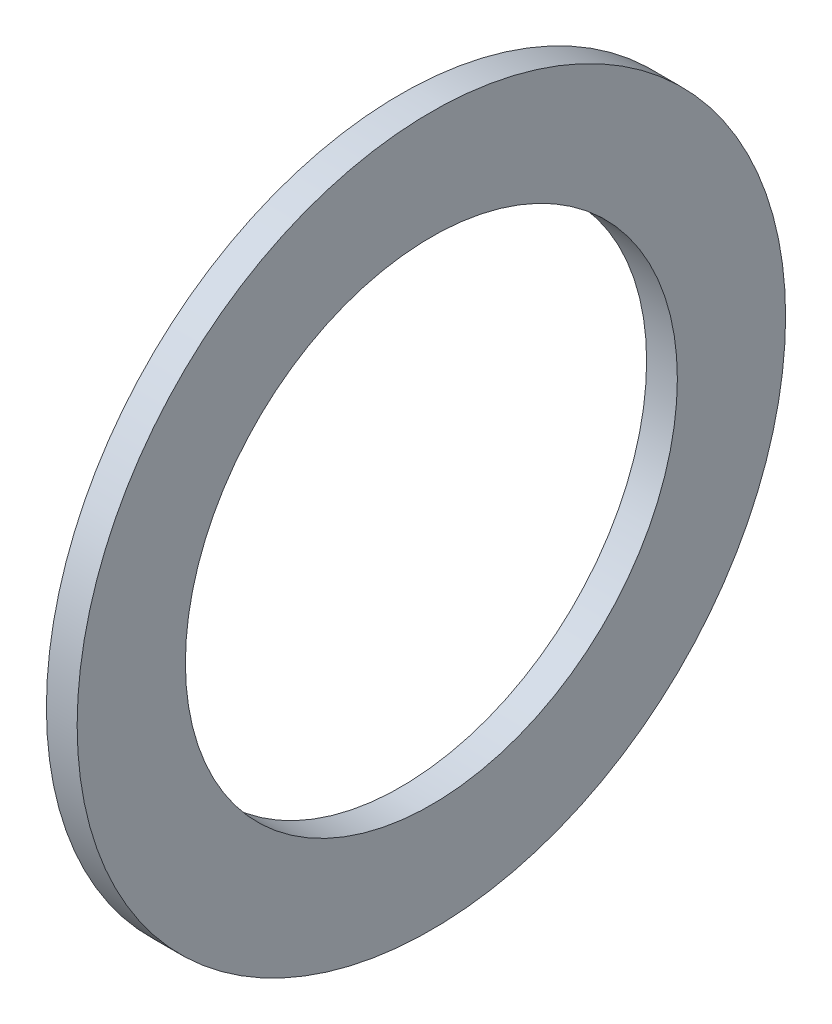
from build123d import *

# Parameters (mm, degrees)
SKETCH1_R           = 73.152
SKETCH1_R_2         = 50.8
BOSS_EXTRUDE1_DEPTH = 6.35


with BuildPart() as part:
    # Sketch1 → Boss-Extrude1 (new body)
    with BuildSketch(Plane(origin=(0, 0, 0), x_dir=(0, 0, -1), z_dir=(1, 0, 0))):
        Circle(SKETCH1_R)
        Circle(SKETCH1_R_2, mode=Mode.SUBTRACT)
    extrude(amount=BOSS_EXTRUDE1_DEPTH)


solid = part.part
